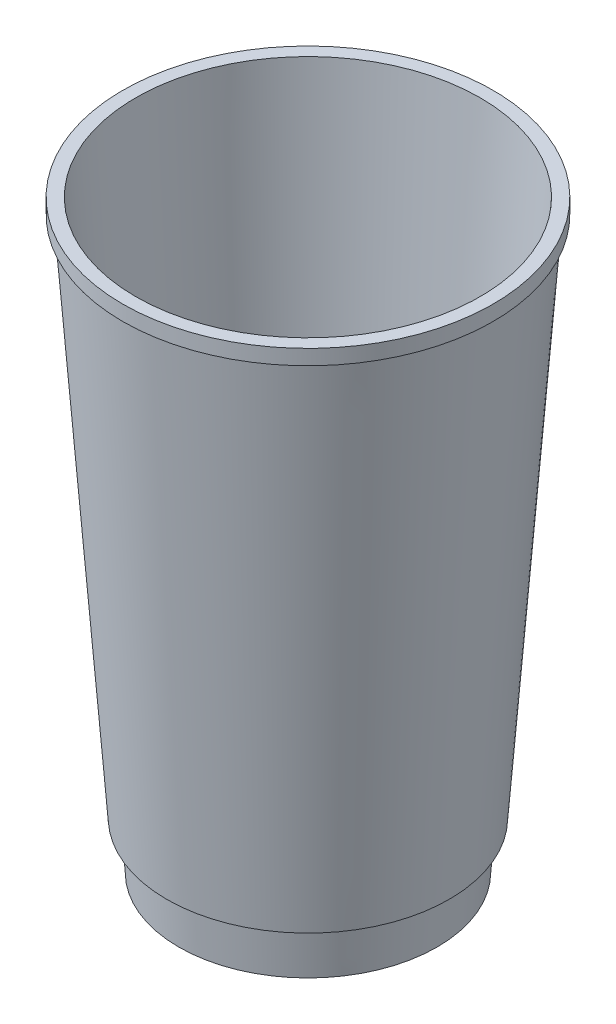
from build123d import *

# Parameters (mm, degrees)
SKETCH_5_R  = 43
SKETCH_6_R  = 43
SKETCH_3_R  = 32.8
SKETCH_4_R  = 41.75
SKETCH_2_R  = 30.775
SKETCH_1_R  = 30
SKETCH_11_R = 29
SKETCH_12_R = 29.775
SKETCH_13_R = 40
SKETCH_14_R = 31.8


with BuildPart() as part:
    # 草图5 → Loft 2 section 0
    with BuildSketch(Plane(origin=(0, 132.3, 0), x_dir=(1, 0, 0), z_dir=(0, 1, 0))):
        Circle(SKETCH_5_R)
    # 草图6 → Loft 2 section 1
    with BuildSketch(Plane(origin=(0, 135.8, 0), x_dir=(1, 0, 0), z_dir=(0, 1, 0))):
        Circle(SKETCH_6_R)
    loft()

    # 草图3 → 放样3 section 0
    with BuildSketch(Plane(origin=(0, 11, 0), x_dir=(1, 0, 0), z_dir=(0, 1, 0))):
        Circle(SKETCH_3_R)
    # 草图4 → 放样3 section 1
    with BuildSketch(Plane(origin=(0, 132.3, 0), x_dir=(1, 0, 0), z_dir=(0, 1, 0))):
        Circle(SKETCH_4_R)
    loft()

    # 草图2 → 放样4 section 0
    with BuildSketch(Plane(origin=(0, 11, 0), x_dir=(1, 0, 0), z_dir=(0, 1, 0))):
        Circle(SKETCH_2_R)
    # 草图1 → 放样4 section 1
    with BuildSketch(Plane(origin=(0, 0, 0), x_dir=(1, 0, 0), z_dir=(0, 1, 0))):
        Circle(SKETCH_1_R)
    loft()

    # 草图11 → 切除-放样1 section 0
    with BuildSketch(Plane(origin=(0, 0, 0), x_dir=(1, 0, 0), z_dir=(0, 1, 0))):
        Circle(SKETCH_11_R)
    # 草图12 → 切除-放样1 section 1
    with BuildSketch(Plane(origin=(0, 11, 0), x_dir=(1, 0, 0), z_dir=(0, 1, 0))):
        Circle(SKETCH_12_R)
    loft(mode=Mode.SUBTRACT)

    # 草图13 → Loft 2 2 section 0
    with BuildSketch(Plane(origin=(0, 135.8, 0), x_dir=(1, 0, 0), z_dir=(0, 1, 0))):
        Circle(SKETCH_13_R)
    # 草图14 → Loft 2 2 section 1
    with BuildSketch(Plane(origin=(0, 12, 0), x_dir=(1, 0, 0), z_dir=(0, 1, 0))):
        Circle(SKETCH_14_R)
    loft(mode=Mode.SUBTRACT)


solid = part.part
